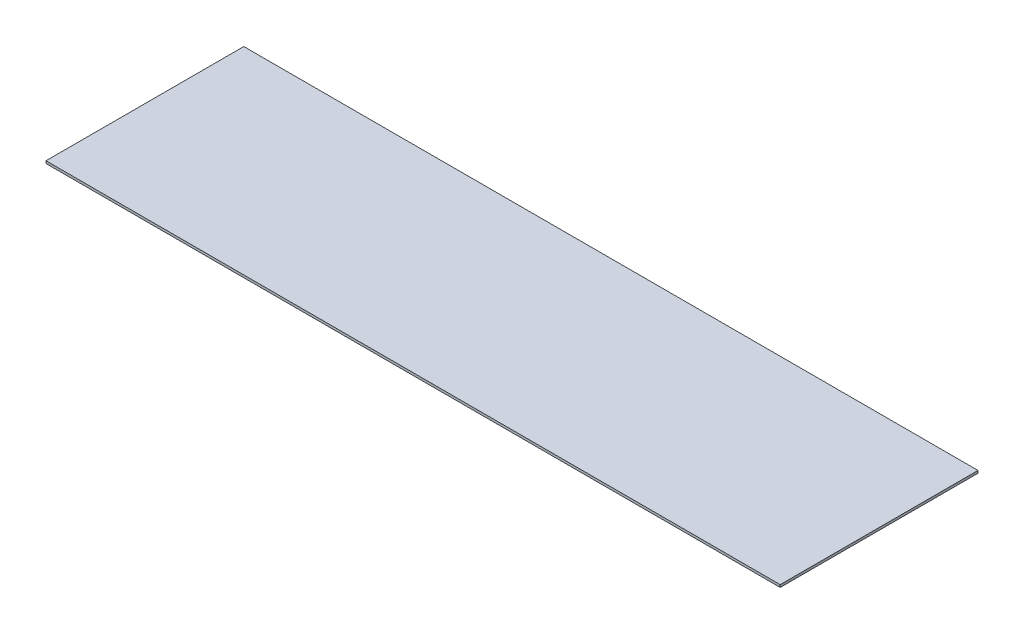
from build123d import *

# Parameters (mm, degrees)
SKETCH1_W           = 150
SKETCH1_H           = 40.41
BOSS_EXTRUDE1_DEPTH = 0.5


with BuildPart() as part:
    # Sketch1 → Boss-Extrude1 (new body)
    with BuildSketch(Plane(origin=(0, 0, 0), x_dir=(1, 0, 0), z_dir=(0, 1, 0))):
        Rectangle(SKETCH1_W, SKETCH1_H)
    extrude(amount=BOSS_EXTRUDE1_DEPTH)


solid = part.part
